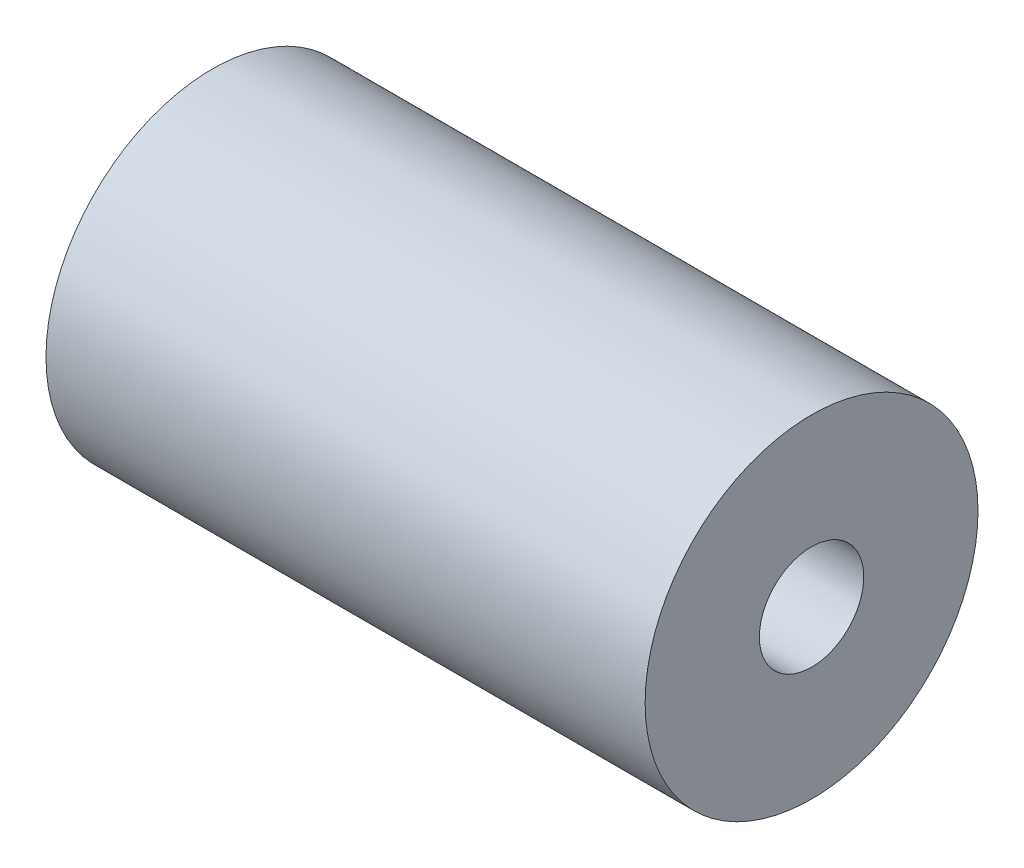
from build123d import *

# Parameters (mm, degrees)
SKETCH1_W = 28.575
SKETCH1_H = 5.4483


with BuildPart() as part:
    # Sketch1 → Revolve1 (revolve)
    with BuildSketch(Plane(origin=(0, 0, 0), x_dir=(1, 0, 0), z_dir=(0, 1, 0)), mode=Mode.PRIVATE) as revolve1_sk:
        with Locations((0, 5.21335)):
            Rectangle(SKETCH1_W, SKETCH1_H)
    revolve(revolve1_sk.sketch.rotate(Axis((-72.893991897, 0, 0), (1, 0, 0)), 180), axis=Axis((-72.893991897, 0, 0), (1, 0, 0)))


solid = part.part
